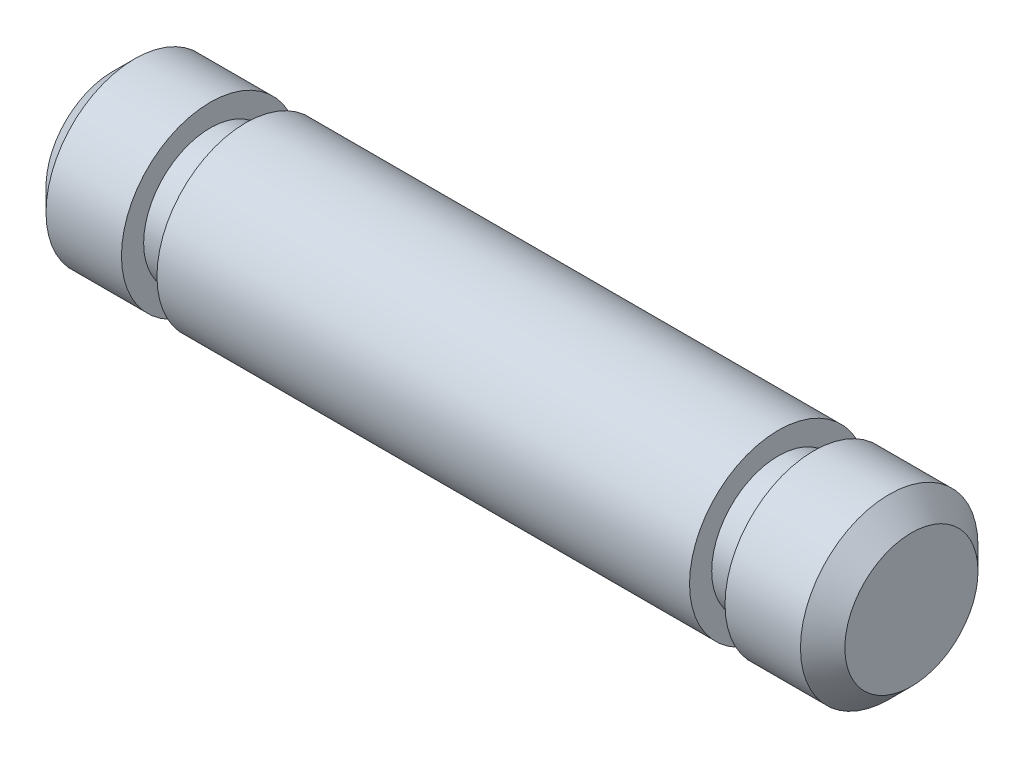
from build123d import *

# Parameters (mm, degrees)
SKETCH1_R           = 2
BOSS_EXTRUDE1_DEPTH = 9
CHAMFER1_SIZE       = 0.5
CUT_EXTRUDE1_START  = -3
SKETCH2_R           = 2
SKETCH2_R_2         = 1.5
CUT_EXTRUDE1_DEPTH  = 0.8


with BuildPart() as part:
    # Sketch1 → Boss-Extrude1 (new, symmetric)
    with BuildSketch(Plane(origin=(0, 0, 0), x_dir=(0, 0, -1), z_dir=(1, 0, 0))):
        Circle(SKETCH1_R)
    extrude(amount=BOSS_EXTRUDE1_DEPTH, both=True)

    # Chamfer1
    chamfer1_edges = [part.edges().sort_by_distance(p)[0] for p in [
        (-9, 0, 2),
        (9, 0, 2),
    ]]
    chamfer(chamfer1_edges, length=CHAMFER1_SIZE)

    # Sketch2 → Cut-Extrude1 (cut)
    with BuildSketch(Plane.ZY.offset(9).offset(CUT_EXTRUDE1_START)):
        Circle(SKETCH2_R)
        Circle(SKETCH2_R_2, mode=Mode.SUBTRACT)
    cut_extrude1 = extrude(amount=CUT_EXTRUDE1_DEPTH, mode=Mode.SUBTRACT)

    # Mirror1: Cut-Extrude1 across plane
    add(cut_extrude1.mirror(Plane(origin=(0, 0, 0), x_dir=(0, 0, 1), z_dir=(1, 0, 0))), mode=Mode.SUBTRACT)


solid = part.part
